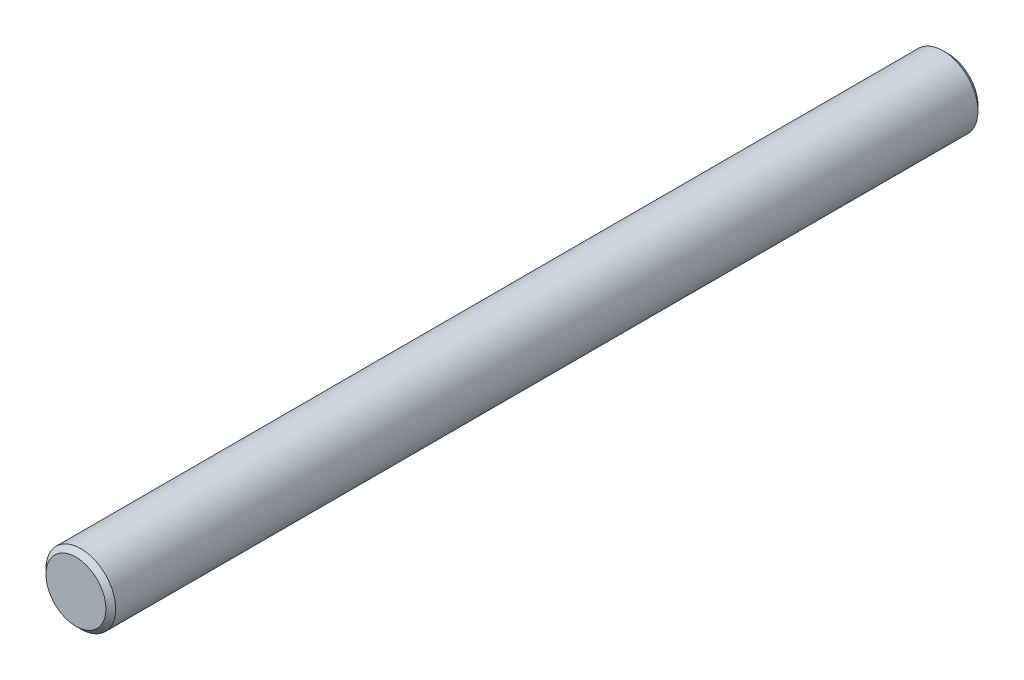
from build123d import *

# Parameters (mm, degrees)
BOSS_EXTRUDE1_DEPTH      = 50
BOSS_EXTRUDE1_DEPTH_BACK = 50
SKETCH3_R                = 4
CHAMFER1_SIZE            = 0.56


with BuildPart() as part:
    # Sketch3 → Boss-Extrude1 (new, two sides: drawn at the far end of the back side and taken through both)
    with BuildSketch(Plane.XY.offset(-BOSS_EXTRUDE1_DEPTH_BACK)):
        Circle(SKETCH3_R)
    extrude(amount=BOSS_EXTRUDE1_DEPTH + BOSS_EXTRUDE1_DEPTH_BACK)

    # Chamfer1
    chamfer1_edges = [part.edges().sort_by_distance(p)[0] for p in [
        (-4, 0, -50),
        (-4, 0, 50),
    ]]
    chamfer(chamfer1_edges, length=CHAMFER1_SIZE)


solid = part.part
